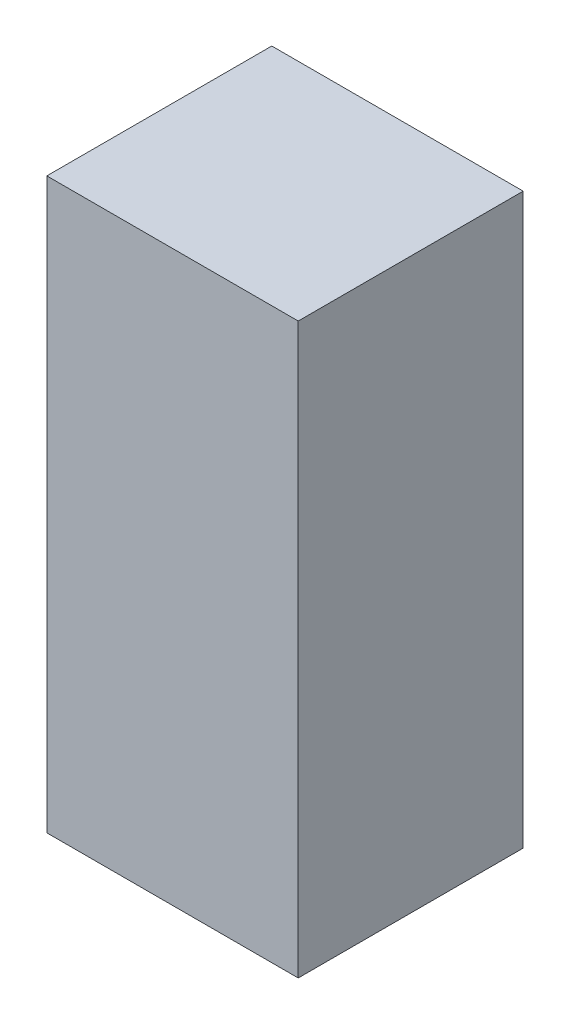
from build123d import *

# Parameters (mm, degrees)
SKETCH_1_W      = 19
SKETCH_1_H      = 17
EXTRUDE_1_DEPTH = 43


with BuildPart() as part:
    # 草图1 → 凸台-拉伸1 (new body)
    with BuildSketch(Plane(origin=(0, 0, 0), x_dir=(1, 0, 0), z_dir=(0, 1, 0))):
        Rectangle(SKETCH_1_W, SKETCH_1_H)
    extrude(amount=EXTRUDE_1_DEPTH)


solid = part.part
